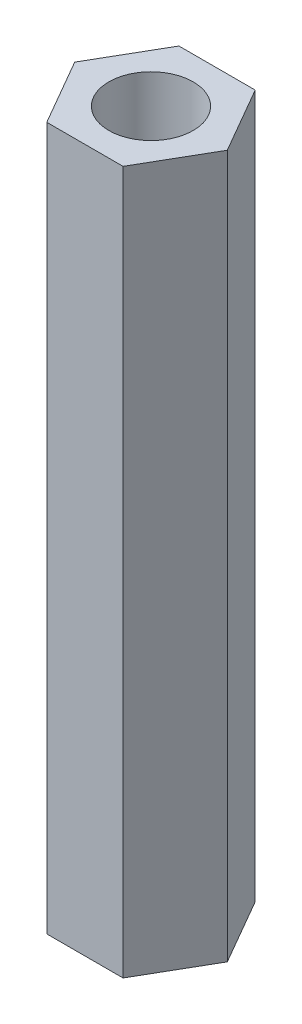
from build123d import *

# Parameters (mm, degrees)
SKETCH_1_R      = 1.5
EXTRUDE_1_DEPTH = 25


with BuildPart() as part:
    # 草图1 → 凸台-拉伸1 (new body)
    with BuildSketch(Plane(origin=(0, 0, 0), x_dir=(1, 0, 0), z_dir=(0, 1, 0))):
        Polygon((1.356773133, -2.35), (2.713546265, 0), (1.356773133, 2.35), (-1.356773133, 2.35), (-2.713546265, 0), (-1.356773133, -2.35), align=None)
        with Locations(Location((0, 0, 0), (0, 0, 270))):
            Circle(SKETCH_1_R, mode=Mode.SUBTRACT)
    extrude(amount=EXTRUDE_1_DEPTH)


solid = part.part
